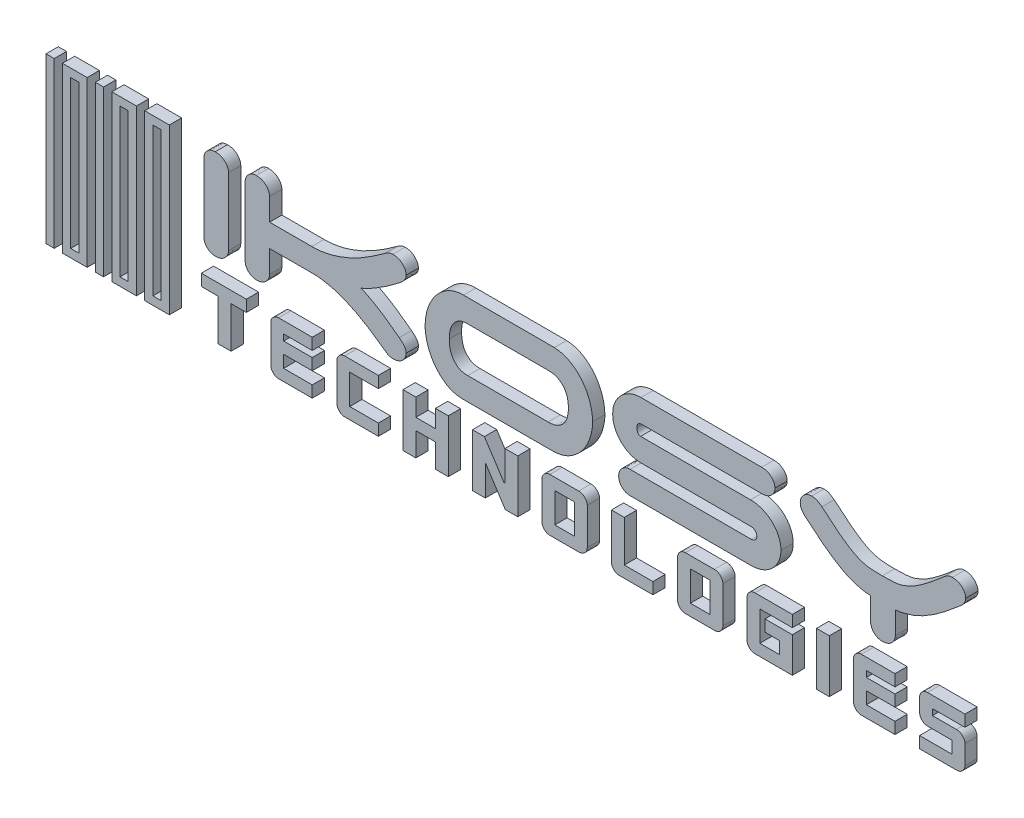
from build123d import *

# Parameters (mm, degrees)
SYMBOL_SKETCH_W        = 1.675
SYMBOL_SKETCH_H        = 33.5
SYMBOL_EXTRUDE_DEPTH   = 2.5
SYMBOL_SKETCH_W_2      = 5.025
SYMBOL_SKETCH_H_2      = 30.15
SYMBOL_EXTRUDE_2_DEPTH = 2.5
SYMBOL_EXTRUDE_3_DEPTH = 2.5
SYMBOL_EXTRUDE_4_DEPTH = 2.5
SYMBOL_EXTRUDE_5_DEPTH = 2.5
TEXT_EXTRUDE_DEPTH     = 2.5
TEXT_EXTRUDE_2_DEPTH   = 2.5
TEXT_EXTRUDE_3_DEPTH   = 2.5
TEXT_EXTRUDE_4_DEPTH   = 2.5
TEXT_EXTRUDE_5_DEPTH   = 2.5
TEXT_EXTRUDE_6_DEPTH   = 2.5
TEXT_EXTRUDE_7_DEPTH   = 2.5
TEXT_EXTRUDE_8_DEPTH   = 2.5
TEXT_EXTRUDE_9_DEPTH   = 2.5
TEXT_EXTRUDE_10_DEPTH  = 2.5
TEXT_SKETCH_W          = 3.996794872
TEXT_SKETCH_H          = 6.064102564
TEXT_EXTRUDE_11_DEPTH  = 2.5
TEXT_EXTRUDE_12_DEPTH  = 2.5
TEXT_EXTRUDE_13_DEPTH  = 2.5
TEXT_EXTRUDE_14_DEPTH  = 2.5
TEXT_SKETCH_W_2        = 2.618589744
TEXT_SKETCH_H_2        = 10.75
TEXT_EXTRUDE_15_DEPTH  = 2.5
TEXT_EXTRUDE_16_DEPTH  = 2.5
TEXT_EXTRUDE_17_DEPTH  = 2.5


with BuildPart() as part:
    # Symbol Sketch → Symbol Extrude (new body)
    with BuildSketch(Plane.XY):
        with Locations((-2.4125, 13.5)):
            Rectangle(SYMBOL_SKETCH_W, SYMBOL_SKETCH_H)
    extrude(amount=SYMBOL_EXTRUDE_DEPTH)


with BuildPart() as body_2:
    # Symbol Sketch → Symbol Extrude 2 (new body)
    with BuildSketch(Plane.XY):
        with Locations((2.6125, 13.5)):
            Rectangle(SYMBOL_SKETCH_W_2, SYMBOL_SKETCH_H)
        with Locations((2.6125, 13.5)):
            Rectangle(SYMBOL_SKETCH_W, SYMBOL_SKETCH_H_2, mode=Mode.SUBTRACT)
    extrude(amount=SYMBOL_EXTRUDE_2_DEPTH)


with BuildPart() as body_3:
    # Symbol Sketch → Symbol Extrude 3 (new body)
    with BuildSketch(Plane.XY):
        with Locations((7.6375, 13.5)):
            Rectangle(SYMBOL_SKETCH_W, SYMBOL_SKETCH_H)
    extrude(amount=SYMBOL_EXTRUDE_3_DEPTH)


with BuildPart() as body_4:
    # Symbol Sketch → Symbol Extrude 4 (new body)
    with BuildSketch(Plane.XY):
        with Locations((12.6625, 13.5)):
            Rectangle(SYMBOL_SKETCH_W_2, SYMBOL_SKETCH_H)
        with Locations((12.6625, 13.5)):
            Rectangle(SYMBOL_SKETCH_W, SYMBOL_SKETCH_H_2, mode=Mode.SUBTRACT)
    extrude(amount=SYMBOL_EXTRUDE_4_DEPTH)


with BuildPart() as body_5:
    # Symbol Sketch → Symbol Extrude 5 (new body)
    with BuildSketch(Plane.XY):
        with Locations((19.3625, 13.5)):
            Rectangle(SYMBOL_SKETCH_W_2, SYMBOL_SKETCH_H)
        with Locations((19.3625, 13.5)):
            Rectangle(SYMBOL_SKETCH_W, SYMBOL_SKETCH_H_2, mode=Mode.SUBTRACT)
    extrude(amount=SYMBOL_EXTRUDE_5_DEPTH)


with BuildPart() as body_6:
    # Text Sketch → Text Extrude (new body)
    with BuildSketch(Plane.XY):
        with BuildLine():
            add(Edge.make_bspline(
                [(33.932145172, 14.108903111), (33.922614042, 13.966464941), (33.903507078, 13.680920527), (33.756814698, 13.266172232), (33.522865011, 12.870067652), (33.203812647, 12.502559297), (32.81468528, 12.173409809), (32.340116527, 11.946153881), (31.804726107, 11.805542545), (31.425469577, 11.78902523), (31.22750324, 11.780403435)],
                knots=[0, 0, 0, 0, 0.862232898, 1.728509904, 2.637124992, 3.638458358, 4.667549052, 5.703761565, 6.801397276, 8, 8, 8, 8], degree=3))
            add(Edge.make_bspline(
                [(31.22750324, 11.780403435), (31.06944086, 11.787950422), (30.761904891, 11.802634309), (30.318705895, 11.932300503), (29.921021184, 12.154395227), (29.561828224, 12.443228094), (29.272995357, 12.802421054), (29.050900632, 13.200105765), (28.921234439, 13.643304761), (28.906550552, 13.95084073), (28.899003564, 14.108903111)],
                knots=[0, 0, 0, 0, 1.033498853, 2.010839451, 2.990522858, 4, 5.009477142, 5.989160549, 6.966501147, 8, 8, 8, 8], degree=3))
            Line((28.899003564, 14.108903111), (28.899003564, 27.876903759))
            add(Edge.make_bspline(
                [(28.899003564, 27.876903759), (28.907033893, 28.032851206), (28.922853275, 28.340060602), (29.048078277, 28.782913745), (29.274796911, 29.178618665), (29.56347736, 29.536410354), (29.919018501, 29.831830551), (30.320514074, 30.054574569), (30.764159418, 30.181885187), (31.071492837, 30.197484712), (31.22750324, 30.205403435)],
                knots=[0, 0, 0, 0, 1.021036462, 2.011395514, 2.980149812, 3.990138669, 5.008424466, 5.988604486, 6.978963538, 8, 8, 8, 8], degree=3))
            add(Edge.make_bspline(
                [(31.22750324, 30.205403435), (31.423350927, 30.196429128), (31.800366674, 30.179153176), (32.336176139, 30.041547398), (32.807589653, 29.803363866), (33.203813659, 29.479883836), (33.522620655, 29.109428844), (33.756883894, 28.713745241), (33.902788255, 28.30078682), (33.922420665, 28.017315427), (33.932145172, 27.876903759)],
                knots=[0, 0, 0, 0, 1.187948747, 2.286855633, 3.329671233, 4.369332619, 5.371825634, 6.281492993, 7.148773238, 8, 8, 8, 8], degree=3))
            Line((33.932145172, 27.876903759), (33.932145172, 14.108903111))
        make_face()
    extrude(amount=TEXT_EXTRUDE_DEPTH)


with BuildPart() as body_7:
    # Text Sketch → Text Extrude 2 (new body)
    with BuildSketch(Plane.XY):
        with BuildLine():
            Line((42.302802981, 23.321403111), (50.894369734, 23.321403111))
            add(Edge.make_bspline(
                [(50.894369734, 23.321403111), (51.236859765, 23.329352598), (51.91914667, 23.345189063), (52.937147227, 23.440022319), (53.939333875, 23.609879412), (55.264327124, 23.914788101), (56.897453942, 24.448179783), (58.821811851, 25.238227135), (60.68251169, 26.185053601), (62.461254445, 27.250703399), (64.162352307, 28.378130344), (65.259760547, 29.165193234), (65.802738172, 29.554617628)],
                knots=[0, 0, 0, 0, 0.625370962, 1.245824342, 1.864700964, 2.479950729, 3.726807079, 4.996086198, 6.27499779, 7.534434493, 8.780083059, 10, 10, 10, 10], degree=3))
            add(Edge.make_bspline(
                [(65.802738172, 29.554617628), (65.930924828, 29.655013993), (66.178529436, 29.848939036), (66.588818131, 30.051070223), (67.003097409, 30.179576829), (67.282544055, 30.196857248), (67.420746922, 30.205403435)],
                knots=[0, 0, 0, 0, 1.095900439, 2.116834999, 3.068663713, 4, 4, 4, 4], degree=3))
            add(Edge.make_bspline(
                [(67.420746922, 30.205403435), (67.616647718, 30.196658037), (67.991838803, 30.179908768), (68.525130836, 30.040324316), (68.994740749, 29.803375031), (69.391616114, 29.480176752), (69.708710831, 29.107563257), (69.951237776, 28.715573734), (70.095684871, 28.300581006), (70.115549381, 28.017247251), (70.125388853, 27.876903759)],
                knots=[0, 0, 0, 0, 1.188770155, 2.27674401, 3.320280665, 4.360660926, 5.363847116, 6.280304729, 7.148184656, 8, 8, 8, 8], degree=3))
            add(Edge.make_bspline(
                [(70.125388853, 27.876903759), (70.12089662, 27.780915742), (70.111970624, 27.590189062), (70.036709068, 27.311340692), (69.914457735, 27.043885233), (69.681849333, 26.69501161), (69.292002315, 26.271037526), (68.920230435, 25.982578593), (68.722318535, 25.829018146)],
                knots=[0, 0, 0, 0, 0.669693301, 1.330670049, 2.00266867, 2.716108566, 4.251827991, 6, 6, 6, 6], degree=3))
            add(Edge.make_bspline(
                [(68.722318535, 25.829018146), (68.384884641, 25.569126035), (67.736192283, 25.06950217), (66.771608464, 24.356770011), (65.815549149, 23.694452694), (64.836164671, 23.050465206), (63.794824961, 22.433270782), (62.909618942, 21.920630259), (62.200425207, 21.5504343), (61.713060142, 21.311872254), (61.270039702, 21.127123432), (60.985053276, 21.031281235), (60.853183733, 20.986932923)],
                knots=[0, 0, 0, 0, 1.377873125, 2.648861836, 3.879417678, 5.140173149, 6.439784966, 7.794983305, 8.44869275, 9.027502601, 9.550003875, 10, 10, 10, 10], degree=3))
            add(Edge.make_bspline(
                [(60.853183733, 20.986932923), (61.176346781, 20.865830526), (61.844021845, 20.615625402), (62.817574581, 20.10696038), (63.812537349, 19.541904628), (64.81629702, 18.938119935), (65.7989301, 18.300166516), (66.757726675, 17.622192439), (67.726462382, 16.906053887), (68.378687404, 16.408437208), (68.716348023, 16.150818211)],
                knots=[0, 0, 0, 0, 0.89323937, 1.845488394, 2.840530647, 3.858234817, 4.879263654, 5.87478663, 6.899764902, 8, 8, 8, 8], degree=3))
            add(Edge.make_bspline(
                [(68.716348023, 16.150818211), (68.916585933, 15.995454257), (69.293003808, 15.70339283), (69.682133926, 15.274661686), (69.921708237, 14.931767786), (70.036316603, 14.665397621), (70.111701204, 14.391714314), (70.120838187, 14.202927967), (70.125388853, 14.108903111)],
                knots=[0, 0, 0, 0, 1.769110466, 3.325667981, 4.028039365, 4.68216811, 5.343655115, 6, 6, 6, 6], degree=3))
            add(Edge.make_bspline(
                [(70.125388853, 14.108903111), (70.115854065, 13.966469479), (70.09673977, 13.680934162), (69.950103478, 13.266116278), (69.715922621, 12.870298508), (69.396824317, 12.500413997), (69.00242558, 12.175252855), (68.52765472, 11.945819855), (67.993861358, 11.806153822), (67.616680419, 11.789206848), (67.420746922, 11.780403435)],
                knots=[0, 0, 0, 0, 0.862519697, 1.729084847, 2.638002162, 3.639668596, 4.678472755, 5.715029937, 6.813030747, 8, 8, 8, 8], degree=3))
            add(Edge.make_bspline(
                [(67.420746922, 11.780403435), (67.282519538, 11.788899076), (67.003023319, 11.80607729), (66.591696478, 11.93458098), (66.184489931, 12.130427022), (65.940846876, 12.320711597), (65.814679196, 12.419248218)],
                knots=[0, 0, 0, 0, 0.939973017, 1.900628496, 2.912865253, 4, 4, 4, 4], degree=3))
            add(Edge.make_bspline(
                [(65.814679196, 12.419248218), (65.259996443, 12.818968023), (64.143710081, 13.623394992), (62.417835584, 14.766151854), (60.64340991, 15.841271258), (59.106363003, 16.627937945), (57.848353336, 17.177962037), (56.892058009, 17.547968314), (55.923292424, 17.87913809), (54.939140829, 18.15894719), (53.943794985, 18.389448918), (52.936095774, 18.547303185), (51.919730959, 18.65665734), (51.236969658, 18.665791087), (50.894369734, 18.670374271)],
                knots=[0, 0, 0, 0, 1.495432356, 3.00952343, 4.526603086, 6.031585771, 6.782144813, 7.529147792, 8.273927562, 9.020803678, 9.766397276, 10.507145663, 11.250906896, 12, 12, 12, 12], degree=3))
            Line((50.894369734, 18.670374271), (42.302802981, 18.670374271))
            Line((42.302802981, 18.670374271), (42.302802981, 14.108903111))
            add(Edge.make_bspline(
                [(42.302802981, 14.108903111), (42.293271477, 13.966465609), (42.274163762, 13.680922534), (42.127477128, 13.266163996), (41.893503758, 12.87010163), (41.574550559, 12.502416518), (41.186407817, 12.175116475), (40.718809015, 11.947115476), (40.195443175, 11.805875135), (39.825994082, 11.789114346), (39.633984122, 11.780403435)],
                knots=[0, 0, 0, 0, 0.869868558, 1.743817038, 2.660478533, 3.670679389, 4.708883383, 5.743368767, 6.827184362, 8, 8, 8, 8], degree=3))
            add(Edge.make_bspline(
                [(39.633984122, 11.780403435), (39.475921741, 11.787950422), (39.168385772, 11.802634309), (38.725186776, 11.932300503), (38.327502065, 12.154395227), (37.968309105, 12.443228094), (37.679476238, 12.802421054), (37.457381514, 13.200105765), (37.32771532, 13.643304761), (37.313031433, 13.95084073), (37.305484446, 14.108903111)],
                knots=[0, 0, 0, 0, 1.033498853, 2.010839451, 2.990522858, 4, 5.009477142, 5.989160549, 6.966501147, 8, 8, 8, 8], degree=3))
            Line((37.305484446, 14.108903111), (37.305484446, 27.876903759))
            add(Edge.make_bspline(
                [(37.305484446, 27.876903759), (37.313515377, 28.032850394), (37.329335946, 28.34005819), (37.454552313, 28.782922971), (37.681303311, 29.17858427), (37.969858014, 29.536545445), (38.324518307, 29.830210928), (38.717503069, 30.051946414), (39.146284047, 30.182256679), (39.442064386, 30.197610471), (39.592190538, 30.205403435)],
                knots=[0, 0, 0, 0, 1.03238026, 2.033742283, 3.013259521, 4.034469437, 5.064068473, 6.043585711, 7.007003139, 8, 8, 8, 8], degree=3))
            add(Edge.make_bspline(
                [(39.592190538, 30.205403435), (39.788034287, 30.196426788), (40.165042456, 30.179146333), (40.700904615, 30.041571865), (41.172131128, 29.803277221), (41.569036365, 29.480201967), (41.886123497, 29.107557234), (42.128652257, 28.715575188), (42.273098915, 28.300580659), (42.292963481, 28.017247136), (42.302802981, 27.876903759)],
                knots=[0, 0, 0, 0, 1.187035174, 2.285096964, 3.327110603, 4.365972454, 5.367694518, 6.282814583, 7.14942786, 8, 8, 8, 8], degree=3))
            Line((42.302802981, 27.876903759), (42.302802981, 23.321403111))
        make_face()
    extrude(amount=TEXT_EXTRUDE_2_DEPTH)


with BuildPart() as body_8:
    # Text Sketch → Text Extrude 3 (new body)
    with BuildSketch(Plane.XY):
        with BuildLine():
            add(Edge.make_bspline(
                [(108.103815619, 20.992903435), (108.098994555, 20.739778597), (108.08923799, 20.227520473), (107.978605779, 19.455852479), (107.819846709, 18.670927302), (107.592341935, 17.883126299), (107.30966344, 17.10213342), (106.957211048, 16.348063398), (106.533786331, 15.627342161), (106.054542305, 14.937440879), (105.510051664, 14.288777697), (104.897582965, 13.695018374), (104.218407849, 13.157346485), (103.48395845, 12.670657099), (102.678457415, 12.271781024), (101.805362662, 11.982853389), (100.865937433, 11.815943879), (100.219420637, 11.792438605), (99.888391121, 11.780403435)],
                knots=[0, 0, 0, 0, 0.887562666, 1.79619349, 2.730230654, 3.696171481, 4.670456872, 5.642035631, 6.612182846, 7.600186341, 8.58641134, 9.579043665, 10.587854658, 11.622157229, 12.665262734, 13.731876165, 14.838675282, 16, 16, 16, 16], degree=3))
            Line((99.888391121, 11.780403435), (81.409656513, 11.780403435))
            add(Edge.make_bspline(
                [(81.409656513, 11.780403435), (81.120080298, 11.805027634), (80.553167744, 11.85323521), (79.733046752, 12.04698083), (78.967087831, 12.342736658), (78.255416533, 12.732920524), (77.60142467, 13.204360111), (76.986876696, 13.722404366), (76.433625026, 14.304728526), (75.929101432, 14.933241115), (75.483864736, 15.609069759), (75.088187379, 16.318602332), (74.75500702, 17.063106591), (74.472482484, 17.82984952), (74.260066763, 18.618017553), (74.106108133, 19.410147191), (74.004026262, 20.202144023), (73.993537332, 20.729895365), (73.98831011, 20.992903435)],
                knots=[0, 0, 0, 0, 1.071895832, 2.098484516, 3.098701618, 4.095024705, 5.085859565, 6.070929021, 7.058325083, 8.046349754, 9.042889575, 10.042755757, 11.042486936, 12.051303591, 13.056635549, 14.052389487, 15.029396535, 16, 16, 16, 16], degree=3))
            add(Edge.make_bspline(
                [(73.98831011, 20.992903435), (73.996453928, 21.259799624), (74.01285149, 21.797194639), (74.107152996, 22.603067742), (74.280494058, 23.407524075), (74.504264709, 24.211021805), (74.791391065, 25.000776499), (75.156734369, 25.754886724), (75.565846808, 26.482279712), (76.044021656, 27.167508049), (76.579761356, 27.806781891), (77.173896669, 28.388337532), (77.820278769, 28.910544264), (78.520884139, 29.365050122), (79.269626885, 29.749506534), (80.080933658, 30.007743163), (80.934941379, 30.176835259), (81.522259541, 30.195758207), (81.821621841, 30.205403435)],
                knots=[0, 0, 0, 0, 0.957572403, 1.928070379, 2.905345163, 3.906550234, 4.91841359, 5.914694441, 6.909080783, 7.909165367, 8.907311603, 9.896765544, 10.886811641, 11.882811104, 12.888485635, 13.895350359, 14.927237742, 16, 16, 16, 16], degree=3))
            Line((81.821621841, 30.205403435), (100.312297472, 30.199432923))
            add(Edge.make_bspline(
                [(100.312297472, 30.199432923), (100.631834833, 30.173539771), (101.254881866, 30.123052242), (102.154007255, 29.91528616), (102.991004153, 29.608985534), (103.749552828, 29.180566938), (104.445481955, 28.69159588), (105.084492434, 28.151229995), (105.658739995, 27.557898158), (106.171435647, 26.918222415), (106.625003555, 26.242207648), (107.022685041, 25.537236437), (107.34793102, 24.798696915), (107.623728828, 24.043325569), (107.836156998, 23.276113324), (107.994136509, 22.51066809), (108.085848702, 21.749435914), (108.097854751, 21.243897545), (108.103815619, 20.992903435)],
                knots=[0, 0, 0, 0, 1.15756904, 2.257075526, 3.324770562, 4.368045022, 5.395925654, 6.396323121, 7.388434129, 8.376048353, 9.355769955, 10.328466472, 11.297804901, 12.26956978, 13.233097401, 14.172774794, 15.092803254, 16, 16, 16, 16], degree=3))
        make_face()
        with BuildLine():
            add(Edge.make_bspline(
                [(99.040578419, 16.431432275), (99.243897065, 16.437081139), (99.632489858, 16.447877533), (100.18802075, 16.531466029), (100.686814716, 16.669738736), (101.123442017, 16.878626023), (101.502358622, 17.127693027), (101.849516883, 17.387082516), (102.1426992, 17.683937178), (102.479176496, 18.107821947), (102.808926063, 18.705236526), (103.029282317, 19.485352924), (103.162093607, 20.251905951), (103.181120372, 20.755602281), (103.190084251, 20.992903435)],
                knots=[0, 0, 0, 0, 1.046644794, 2.000400019, 2.885908836, 3.701969816, 4.480954947, 5.218948154, 5.92916188, 6.622234248, 8.002950174, 9.406752558, 10.778270606, 12, 12, 12, 12], degree=3))
            add(Edge.make_bspline(
                [(103.190084251, 20.992903435), (103.181274628, 21.230249801), (103.162648178, 21.732078326), (103.027885498, 22.495942577), (102.811647688, 23.274420867), (102.473946787, 23.866050185), (102.145204484, 24.298008061), (101.84133427, 24.590086005), (101.498840838, 24.859046486), (101.115885942, 25.108473533), (100.677889717, 25.313462087), (100.180461639, 25.455602039), (99.628403665, 25.537344971), (99.241871168, 25.548543032), (99.040578419, 25.554374595)],
                knots=[0, 0, 0, 0, 1.222567146, 2.584910299, 3.989675285, 5.362363695, 6.06397828, 6.781967681, 7.526778103, 8.306297391, 9.132203488, 10.00847181, 10.962881034, 12, 12, 12, 12], degree=3))
            Line((99.040578419, 25.554374595), (82.675405055, 25.554374595))
            add(Edge.make_bspline(
                [(82.675405055, 25.554374595), (82.497937462, 25.550752617), (82.157052429, 25.543795413), (81.674107929, 25.465025615), (81.240000806, 25.342278181), (80.744603668, 25.102511717), (80.206936937, 24.7019452), (79.681172218, 24.100128412), (79.297137346, 23.381220865), (79.05673027, 22.592580808), (78.928941369, 21.787289462), (78.910815651, 21.252015283), (78.902041478, 20.992903435)],
                knots=[0, 0, 0, 0, 0.794200639, 1.525524215, 2.185566194, 2.807611374, 3.980821995, 5.16243582, 6.359119684, 7.602475229, 8.839422673, 10, 10, 10, 10], degree=3))
            add(Edge.make_bspline(
                [(78.902041478, 20.992903435), (78.910672361, 20.731755998), (78.928497016, 20.192429643), (79.058136414, 19.38447879), (79.288564784, 18.590088861), (79.680517926, 17.875383855), (80.208600434, 17.280468803), (80.736550278, 16.875748608), (81.232707834, 16.6424747), (81.666311803, 16.521535944), (82.153033754, 16.441567634), (82.495934168, 16.434914476), (82.675405055, 16.431432275)],
                knots=[0, 0, 0, 0, 1.168189698, 2.412566253, 3.651898492, 4.851533932, 6.025141351, 7.189898139, 7.799403787, 8.467261891, 9.19777913, 10, 10, 10, 10], degree=3))
            Line((82.675405055, 16.431432275), (99.040578419, 16.431432275))
        make_face(mode=Mode.SUBTRACT)
    extrude(amount=TEXT_EXTRUDE_3_DEPTH)


with BuildPart() as body_9:
    # Text Sketch → Text Extrude 4 (new body)
    with BuildSketch(Plane.XY):
        with BuildLine():
            add(Edge.make_bspline(
                [(117.967101426, 18.670374271), (117.767826032, 18.676573655), (117.373494254, 18.68884117), (116.792509249, 18.772488617), (116.235047021, 18.91752527), (115.700181195, 19.114296202), (115.197637637, 19.36658068), (114.720921592, 19.651670476), (114.285465013, 19.985000758), (113.874989484, 20.345776911), (113.514213331, 20.75625244), (113.180883049, 21.191709019), (112.895793252, 21.668425065), (112.643508775, 22.170968622), (112.446737843, 22.705834449), (112.30170119, 23.263296677), (112.218053743, 23.844281681), (112.205786228, 24.238613459), (112.199586844, 24.437888853)],
                knots=[0, 0, 0, 0, 1.055198062, 2.088055732, 3.10027589, 4.100630988, 5.099819621, 6.074018954, 7.037268981, 8, 8.962731019, 9.925981046, 10.900180379, 11.899369012, 12.89972411, 13.911944268, 14.944801938, 16, 16, 16, 16], degree=3))
            add(Edge.make_bspline(
                [(112.199586844, 24.437888853), (112.205793792, 24.637167824), (112.218076278, 25.031506681), (112.301339136, 25.610528318), (112.446155917, 26.167058901), (112.650978508, 26.697506801), (112.901267048, 27.201594027), (113.187073415, 27.677939183), (113.519793903, 28.113978979), (113.883188602, 28.523490725), (114.289668408, 28.893366911), (114.732857304, 29.221330903), (115.207558828, 29.511175179), (115.716635677, 29.753921897), (116.248103026, 29.958143698), (116.804512167, 30.10300862), (117.379405186, 30.187012652), (117.769802299, 30.199229352), (117.967101426, 30.205403435)],
                knots=[0, 0, 0, 0, 1.056069126, 2.089779418, 3.092625705, 4.097522181, 5.097535642, 6.072539174, 7.036584362, 8.000110114, 8.970710769, 9.943200813, 10.918204345, 11.913590283, 12.928346752, 13.931193039, 14.954465097, 16, 16, 16, 16], degree=3))
            Line((117.967101426, 30.205403435), (142.553669799, 30.205403435))
            add(Edge.make_bspline(
                [(142.553669799, 30.205403435), (142.749513548, 30.196426788), (143.126521717, 30.179146333), (143.662383876, 30.041571865), (144.133610389, 29.803277221), (144.530515626, 29.480201967), (144.847602758, 29.107557234), (145.090131519, 28.715575188), (145.234578177, 28.300580659), (145.254442742, 28.017247136), (145.264282242, 27.876903759)],
                knots=[0, 0, 0, 0, 1.187035174, 2.285096964, 3.327110603, 4.365972454, 5.367694518, 6.282814583, 7.14942786, 8, 8, 8, 8], degree=3))
            add(Edge.make_bspline(
                [(145.264282242, 27.876903759), (145.254558795, 27.736489983), (145.234928523, 27.453014335), (145.089007628, 27.040088822), (144.854812725, 26.644269206), (144.53571872, 26.274385466), (144.141318469, 25.949223258), (143.666549111, 25.719793784), (143.130817234, 25.579607633), (142.751610265, 25.563028604), (142.553669799, 25.554374595)],
                knots=[0, 0, 0, 0, 0.850520932, 1.717082035, 2.625995105, 3.627656861, 4.666456168, 5.70300851, 6.801004192, 8, 8, 8, 8], degree=3))
            Line((142.553669799, 25.554374595), (117.88948477, 25.554374595))
            add(Edge.make_bspline(
                [(117.88948477, 25.554374595), (117.813693239, 25.537232398), (117.62716047, 25.495043232), (117.429143648, 25.322383553), (117.262655636, 25.138264225), (117.175018573, 24.938359985), (117.121513826, 24.701504313), (117.116175554, 24.529796523), (117.113318211, 24.437888853)],
                knots=[0, 0, 0, 0, 0.929705688, 2.288126067, 3.074503345, 3.925707183, 4.889721779, 6, 6, 6, 6], degree=3))
            add(Edge.make_bspline(
                [(117.113318211, 24.437888853), (117.116153737, 24.349925916), (117.121500042, 24.184074209), (117.177186883, 23.951978296), (117.262629401, 23.750174212), (117.426348787, 23.558642274), (117.628647155, 23.388903106), (117.813879252, 23.340968434), (117.88948477, 23.321403111)],
                knots=[0, 0, 0, 0, 1.066464062, 2.010788751, 2.887353709, 3.695542847, 5.059398025, 6, 6, 6, 6], degree=3))
            Line((117.88948477, 23.321403111), (140.284875243, 23.321403111))
            add(Edge.make_bspline(
                [(140.284875243, 23.321403111), (140.506126286, 23.316172652), (140.94477772, 23.305802766), (141.591380853, 23.207561896), (142.215157032, 23.045924503), (142.811017763, 22.823018293), (143.37304302, 22.558547849), (143.89309044, 22.25100522), (144.365254622, 21.905130974), (144.789814034, 21.521663946), (145.170686172, 21.106374178), (145.501954281, 20.657479368), (145.800968925, 20.183915297), (146.0407417, 19.676914162), (146.24054355, 19.155214304), (146.37771894, 18.616203761), (146.46373728, 18.068134257), (146.476088556, 17.697491275), (146.482266688, 17.512094945)],
                knots=[0, 0, 0, 0, 1.125524374, 2.23146012, 3.319860629, 4.399933111, 5.464745038, 6.47755185, 7.470303123, 8.438566666, 9.385019312, 10.333150884, 11.274821239, 12.230766696, 13.182786281, 14.113937299, 15.056587825, 16, 16, 16, 16], degree=3))
            add(Edge.make_bspline(
                [(146.482266688, 17.512094945), (146.475923937, 17.326742819), (146.463243556, 16.956188208), (146.379605245, 16.406955325), (146.233407915, 15.871767761), (146.037020814, 15.354077115), (145.791235887, 14.856108959), (145.498297006, 14.385006737), (145.160952166, 13.93891237), (144.779724109, 13.522795673), (144.357654595, 13.137604283), (143.882159818, 12.803375097), (143.371510524, 12.494487552), (142.810088344, 12.244245829), (142.219996632, 12.028470321), (141.595188683, 11.89167754), (140.948543357, 11.796281326), (140.508139085, 11.785744898), (140.284875243, 11.780403435)],
                knots=[0, 0, 0, 0, 0.947658347, 1.894551617, 2.832491261, 3.779275183, 4.721235255, 5.667143943, 6.611409382, 7.57649714, 8.549118708, 9.52614791, 10.54351323, 11.595303979, 12.663746289, 13.749776913, 14.859244828, 16, 16, 16, 16], degree=3))
            Line((140.284875243, 11.780403435), (115.740100454, 11.780403435))
            add(Edge.make_bspline(
                [(115.740100454, 11.780403435), (115.58404776, 11.788114315), (115.278545022, 11.803209824), (114.83727467, 11.932297149), (114.439588618, 12.154396157), (114.080396028, 12.443227841), (113.791563061, 12.80242112), (113.569468363, 13.200105748), (113.439802162, 13.643304766), (113.425118277, 13.950840732), (113.41757129, 14.108903111)],
                knots=[0, 0, 0, 0, 1.022177595, 2.001106468, 2.982381959, 3.993499602, 5.004617245, 5.985892735, 6.964821609, 8, 8, 8, 8], degree=3))
            add(Edge.make_bspline(
                [(113.41757129, 14.108903111), (113.425608371, 14.264842559), (113.441441055, 14.572036197), (113.566569286, 15.015003974), (113.79365064, 15.410279222), (114.080126494, 15.768745232), (114.439658444, 16.057403967), (114.837256362, 16.279547891), (115.278549831, 16.408623434), (115.584049386, 16.423720566), (115.740100454, 16.431432275)],
                knots=[0, 0, 0, 0, 1.023700639, 2.016643822, 2.987925878, 4.000550086, 5.013174293, 5.995911884, 6.976299361, 8, 8, 8, 8], degree=3))
            Line((115.740100454, 16.431432275), (140.452049579, 16.431432275))
            add(Edge.make_bspline(
                [(140.452049579, 16.431432275), (140.595308378, 16.445480381), (140.885343765, 16.47392155), (141.189737596, 16.693027008), (141.389034421, 16.905666708), (141.488466705, 17.09718427), (141.562474746, 17.297704917), (141.566489843, 17.439737111), (141.568535321, 17.512094945)],
                knots=[0, 0, 0, 0, 1.483557837, 3.00354516, 3.785710979, 4.522423995, 5.247253764, 6, 6, 6, 6], degree=3))
            add(Edge.make_bspline(
                [(141.568535321, 17.512094945), (141.563347173, 17.590084756), (141.553341951, 17.74048629), (141.492049242, 17.959432237), (141.381949002, 18.157762196), (141.233271931, 18.332857523), (141.062190937, 18.483687581), (140.871302125, 18.59234404), (140.664763601, 18.654847666), (140.524107867, 18.66511453), (140.452049579, 18.670374271)],
                knots=[0, 0, 0, 0, 1.052637569, 2.029987015, 3.039270143, 4.08779047, 5.115827877, 6.101623483, 7.027456916, 8, 8, 8, 8], degree=3))
            Line((140.452049579, 18.670374271), (117.967101426, 18.670374271))
        make_face()
    extrude(amount=TEXT_EXTRUDE_4_DEPTH)


with BuildPart() as body_10:
    # Text Sketch → Text Extrude 5 (new body)
    with BuildSketch(Plane.XY):
        with BuildLine():
            add(Edge.make_bspline(
                [(169.785174984, 14.108903111), (169.775640196, 13.966469478), (169.7565259, 13.680934159), (169.609889613, 13.266116288), (169.375708737, 12.870298463), (169.056610511, 12.500414184), (168.662211468, 12.175252131), (168.187441779, 11.945822615), (167.651709996, 11.805636476), (167.272503014, 11.789057445), (167.074562541, 11.780403435)],
                knots=[0, 0, 0, 0, 0.861224399, 1.726488175, 2.634040514, 3.634202684, 4.671446808, 5.70644733, 6.802799205, 8, 8, 8, 8], degree=3))
            add(Edge.make_bspline(
                [(167.074562541, 11.780403435), (166.918509847, 11.788114315), (166.613007109, 11.803209824), (166.171736757, 11.932297149), (165.774050705, 12.154396157), (165.414858115, 12.443227841), (165.126025148, 12.80242112), (164.90393045, 13.200105748), (164.774264249, 13.643304766), (164.759580363, 13.950840732), (164.752033377, 14.108903111)],
                knots=[0, 0, 0, 0, 1.022177595, 2.001106468, 2.982381959, 3.993499602, 5.004617245, 5.985892735, 6.964821609, 8, 8, 8, 8], degree=3))
            Line((164.752033377, 14.108903111), (164.752033377, 18.670374271))
            add(Edge.make_bspline(
                [(164.752033377, 18.670374271), (164.542760822, 18.674234631), (164.108690089, 18.682241745), (163.443951576, 18.776401774), (162.73853887, 18.897315269), (162.005219937, 19.084183228), (161.246085879, 19.324044372), (160.469376603, 19.615858209), (159.680287482, 19.969665537), (158.877625079, 20.386557884), (158.048511011, 20.858728965), (157.201357226, 21.404830958), (156.316106751, 22.003466698), (155.40517876, 22.674684194), (154.450120482, 23.413847072), (153.449447625, 24.227156146), (152.392084547, 25.110337465), (151.675658489, 25.730380854), (151.306440376, 26.04992709)],
                knots=[0, 0, 0, 0, 0.641398825, 1.330382084, 2.055978345, 2.836185825, 3.648952849, 4.496988013, 5.379557769, 6.299582378, 7.270216231, 8.304862195, 9.390111043, 10.547532482, 11.774599775, 13.093996411, 14.502358824, 16, 16, 16, 16], degree=3))
            add(Edge.make_bspline(
                [(151.306440376, 26.04992709), (151.189006949, 26.167957817), (150.947903315, 26.410287775), (150.657981861, 26.843712509), (150.447031447, 27.339995479), (150.422935578, 27.697696162), (150.410863577, 27.876903759)],
                knots=[0, 0, 0, 0, 0.953032214, 1.956679093, 2.976298768, 4, 4, 4, 4], degree=3))
            add(Edge.make_bspline(
                [(150.410863577, 27.876903759), (150.418893906, 28.032851206), (150.434713288, 28.340060602), (150.55993829, 28.782913745), (150.786656924, 29.178618665), (151.075337373, 29.536410354), (151.430878514, 29.831830551), (151.832374087, 30.054574569), (152.276019431, 30.181885187), (152.58335285, 30.197484712), (152.739363253, 30.205403435)],
                knots=[0, 0, 0, 0, 1.021036462, 2.011395514, 2.980149812, 3.990138669, 5.008424466, 5.988604486, 6.978963538, 8, 8, 8, 8], degree=3))
            add(Edge.make_bspline(
                [(152.739363253, 30.205403435), (152.937832621, 30.199933525), (153.298072053, 30.190005156), (153.722175862, 30.05121232), (154.01629083, 29.890651276), (154.258928188, 29.744562647), (154.530836701, 29.565999418), (154.721877452, 29.433661028), (154.823071938, 29.363561244)],
                knots=[0, 0, 0, 0, 1.550277569, 2.813890719, 3.449254088, 4.17735297, 5.034541965, 6, 6, 6, 6], degree=3))
            add(Edge.make_bspline(
                [(154.823071938, 29.363561244), (155.232045349, 29.010128564), (156.007722684, 28.339792275), (157.122311852, 27.407741649), (158.124057841, 26.605368451), (159.025918389, 25.926315012), (159.846766108, 25.347090968), (160.61431779, 24.866740563), (161.32927606, 24.459748785), (162.000940376, 24.132935749), (162.645843149, 23.880474893), (163.262143554, 23.674442588), (163.863612145, 23.529853955), (164.457209892, 23.439128272), (165.064063058, 23.391058114), (165.706736442, 23.346293988), (166.395749284, 23.323551995), (166.871553079, 23.322133125), (167.116356124, 23.321403111)],
                knots=[0, 0, 0, 0, 1.836146017, 3.482516976, 4.935327597, 6.195494878, 7.317033276, 8.346813987, 9.270068544, 10.110663513, 10.881484832, 11.621201485, 12.31645431, 12.980022201, 13.658809721, 14.383734916, 15.168424845, 16, 16, 16, 16], degree=3))
            add(Edge.make_bspline(
                [(167.116356124, 23.321403111), (167.373108675, 23.321924823), (167.868826281, 23.322932104), (168.58545423, 23.348139987), (169.24617539, 23.384705581), (169.86730106, 23.426016131), (170.470371073, 23.518587398), (171.084951806, 23.660989979), (171.716466722, 23.876208002), (172.381025619, 24.139019775), (173.079060199, 24.478678289), (173.817012835, 24.898140943), (174.599359752, 25.398072664), (175.282906471, 25.866472519), (175.856577477, 26.296873411), (176.330123331, 26.654684064), (176.833856503, 27.050632133), (177.364126392, 27.484362083), (177.93196383, 27.944540784), (178.520645886, 28.449369852), (179.145683531, 28.982269952), (179.569273708, 29.353123116), (179.785782566, 29.542676604)],
                knots=[0, 0, 0, 0, 1.057356201, 2.041460081, 2.952579034, 3.782999482, 4.603695654, 5.462550415, 6.377495452, 7.348542422, 8.404309042, 9.571413422, 10.842502825, 12.227097685, 12.982804895, 13.795894059, 14.67148133, 15.621299327, 16.617244161, 17.6814085, 18.81490264, 20, 20, 20, 20], degree=3))
            add(Edge.make_bspline(
                [(179.785782566, 29.542676604), (179.917881956, 29.645299245), (180.169804726, 29.841007794), (180.584862955, 30.043366879), (180.996999843, 30.181259762), (181.277361662, 30.197425128), (181.41573234, 30.205403435)],
                knots=[0, 0, 0, 0, 1.116180587, 2.128634399, 3.076400182, 4, 4, 4, 4], degree=3))
            add(Edge.make_bspline(
                [(181.41573234, 30.205403435), (181.611576089, 30.196426788), (181.988584257, 30.179146333), (182.524446416, 30.041571865), (182.99567293, 29.803277221), (183.392578166, 29.480201967), (183.709665298, 29.107557234), (183.952194059, 28.715575188), (184.096640717, 28.300580659), (184.116505283, 28.017247136), (184.126344783, 27.876903759)],
                knots=[0, 0, 0, 0, 1.187035174, 2.285096964, 3.327110603, 4.365972454, 5.367694518, 6.282814583, 7.14942786, 8, 8, 8, 8], degree=3))
            add(Edge.make_bspline(
                [(184.126344783, 27.876903759), (184.114715549, 27.723810257), (184.090436146, 27.404183114), (183.880819259, 26.93644629), (183.547446326, 26.472883595), (183.252401018, 26.19801289), (183.093446209, 26.04992709)],
                knots=[0, 0, 0, 0, 0.846631323, 1.767588747, 2.797294875, 4, 4, 4, 4], degree=3))
            add(Edge.make_bspline(
                [(183.093446209, 26.04992709), (182.749699879, 25.754744277), (182.073641622, 25.174197633), (181.067906281, 24.3295757), (180.074588339, 23.544338226), (179.111930297, 22.80141617), (178.168075082, 22.123551802), (177.258072074, 21.497142594), (176.363987456, 20.94941229), (175.499203755, 20.454631135), (174.648710578, 20.031332823), (173.815617155, 19.661935639), (172.990776845, 19.358950689), (172.193027531, 19.111815765), (171.452105733, 18.925164371), (170.803150446, 18.786867305), (170.259367899, 18.694649463), (169.930709121, 18.677824549), (169.785174984, 18.670374271)],
                knots=[0, 0, 0, 0, 1.405337354, 2.763927467, 4.073070632, 5.332368463, 6.535021961, 7.676977369, 8.757910683, 9.786166288, 10.766154311, 11.703149807, 12.611296932, 13.489908946, 14.292364098, 14.980007543, 15.548334831, 16, 16, 16, 16], degree=3))
            Line((169.785174984, 18.670374271), (169.785174984, 14.108903111))
        make_face()
    extrude(amount=TEXT_EXTRUDE_5_DEPTH)


with BuildPart() as body_11:
    # Text Sketch → Text Extrude 6 (new body)
    with BuildSketch(Plane.XY):
        Polygon((37.566446314, 5.019230769), (34.452564103, 5.019230769), (34.452564103, -3.387820513), (31.833974359, -3.387820513), (31.833974359, 5.019230769), (28.388461538, 5.019230769), (28.388461538, 7.362179487), (37.566446314, 7.362179487), align=None)
    extrude(amount=TEXT_EXTRUDE_6_DEPTH)


with BuildPart() as body_12:
    # Text Sketch → Text Extrude 7 (new body)
    with BuildSketch(Plane.XY):
        with BuildLine():
            Line((50.991973157, -3.387820513), (44.141862981, -3.387820513))
            add(Edge.make_bspline(
                [(44.141862981, -3.387820513), (44.087903849, -3.38706862), (43.981584766, -3.385587118), (43.825611592, -3.359109363), (43.674364237, -3.325283537), (43.530919239, -3.268046303), (43.391010057, -3.203473258), (43.257736019, -3.119673336), (43.13174288, -3.020486706), (43.011757549, -2.909281054), (42.901509135, -2.787661866), (42.80898053, -2.655633375), (42.72344583, -2.522086803), (42.661131143, -2.378654347), (42.607029782, -2.231116722), (42.572809295, -2.076766955), (42.546135829, -1.917210814), (42.544726288, -1.808748844), (42.54400641, -1.753355369)],
                knots=[0, 0, 0, 0, 1.018185487, 2.006195112, 2.983343043, 3.940706292, 4.917571715, 5.89245729, 6.90729392, 7.943926622, 8.981446471, 10.00170814, 10.988133445, 11.971569574, 12.949752669, 13.953284623, 14.95470571, 16, 16, 16, 16], degree=3))
            Line((42.54400641, -1.753355369), (42.54400641, 5.727714343))
            add(Edge.make_bspline(
                [(42.54400641, 5.727714343), (42.544829941, 5.782373888), (42.546463511, 5.890797484), (42.572182671, 6.049837501), (42.607697224, 6.203810616), (42.660247875, 6.351636601), (42.727364144, 6.493237432), (42.806792807, 6.630910703), (42.90484425, 6.759293568), (43.014446342, 6.881473283), (43.132404851, 6.99524272), (43.261324769, 7.09130665), (43.391978472, 7.177641024), (43.531998882, 7.24334942), (43.675362087, 7.298760441), (43.826220038, 7.333874075), (43.981605807, 7.359870553), (44.087910932, 7.361402163), (44.141862981, 7.362179487)],
                knots=[0, 0, 0, 0, 1.032407883, 2.047901701, 3.038877924, 4.01769447, 5.007461449, 5.999181091, 7.017211835, 8.055403561, 9.1019911, 10.109195778, 11.091957287, 12.057221282, 13.027910023, 13.992505718, 14.981155157, 16, 16, 16, 16], degree=3))
            Line((44.141862981, 7.362179487), (50.991973157, 7.362179487))
            Line((50.991973157, 7.362179487), (50.991973157, 5.019230769))
            Line((50.991973157, 5.019230769), (45.162596154, 5.019230769))
            Line((45.162596154, 5.019230769), (45.162596154, 3.778846154))
            Line((45.162596154, 3.778846154), (50.991973157, 3.778846154))
            Line((50.991973157, 3.778846154), (50.991973157, 1.435897436))
            Line((50.991973157, 1.435897436), (45.162596154, 1.435897436))
            Line((45.162596154, 1.435897436), (45.162596154, -1.044871795))
            Line((45.162596154, -1.044871795), (50.991973157, -1.044871795))
            Line((50.991973157, -1.044871795), (50.991973157, -3.387820513))
        make_face()
    extrude(amount=TEXT_EXTRUDE_7_DEPTH)


with BuildPart() as body_13:
    # Text Sketch → Text Extrude 8 (new body)
    with BuildSketch(Plane.XY):
        with BuildLine():
            Line((64.458415465, -3.387820513), (57.608305288, -3.387820513))
            add(Edge.make_bspline(
                [(57.608305288, -3.387820513), (57.554346156, -3.38706862), (57.448027074, -3.385587118), (57.2920539, -3.359109363), (57.140806545, -3.325283537), (56.997361546, -3.268046303), (56.857452364, -3.203473258), (56.724178326, -3.119673336), (56.598185188, -3.020486706), (56.478199857, -2.909281054), (56.367951442, -2.787661866), (56.275422837, -2.655633375), (56.189888138, -2.522086803), (56.12757345, -2.378654347), (56.07347209, -2.231116722), (56.039251602, -2.076766955), (56.012578137, -1.917210814), (56.011168596, -1.808748844), (56.010448718, -1.753355369)],
                knots=[0, 0, 0, 0, 1.018185487, 2.006195112, 2.983343043, 3.940706292, 4.917571715, 5.89245729, 6.90729392, 7.943926622, 8.981446471, 10.00170814, 10.988133445, 11.971569574, 12.949752669, 13.953284623, 14.95470571, 16, 16, 16, 16], degree=3))
            Line((56.010448718, -1.753355369), (56.010448718, 5.727714343))
            add(Edge.make_bspline(
                [(56.010448718, 5.727714343), (56.011272249, 5.782373888), (56.012905819, 5.890797484), (56.038624978, 6.049837501), (56.074139532, 6.203810616), (56.126690183, 6.351636601), (56.193806452, 6.493237432), (56.273235114, 6.630910703), (56.371286557, 6.759293568), (56.48088865, 6.881473283), (56.598847159, 6.99524272), (56.727767077, 7.09130665), (56.858420779, 7.177641024), (56.99844119, 7.24334942), (57.141804395, 7.298760441), (57.292662346, 7.333874075), (57.448048114, 7.359870553), (57.55435324, 7.361402163), (57.608305288, 7.362179487)],
                knots=[0, 0, 0, 0, 1.032407883, 2.047901701, 3.038877924, 4.01769447, 5.007461449, 5.999181091, 7.017211835, 8.055403561, 9.1019911, 10.109195778, 11.091957287, 12.057221282, 13.027910023, 13.992505718, 14.981155157, 16, 16, 16, 16], degree=3))
            Line((57.608305288, 7.362179487), (64.458415465, 7.362179487))
            Line((64.458415465, 7.362179487), (64.458415465, 5.019230769))
            Line((64.458415465, 5.019230769), (58.629038462, 5.019230769))
            Line((58.629038462, 5.019230769), (58.629038462, -1.044871795))
            Line((58.629038462, -1.044871795), (64.458415465, -1.044871795))
            Line((64.458415465, -1.044871795), (64.458415465, -3.387820513))
        make_face()
    extrude(amount=TEXT_EXTRUDE_8_DEPTH)


with BuildPart() as body_14:
    # Text Sketch → Text Extrude 9 (new body)
    with BuildSketch(Plane.XY):
        Polygon((78.710865385, -3.387820513), (76.092275641, -3.387820513), (76.092275641, 1.435897436), (72.095480769, 1.435897436), (72.095480769, -3.387820513), (69.476891026, -3.387820513), (69.476891026, 7.362179487), (72.095480769, 7.362179487), (72.095480769, 3.778846154), (76.092275641, 3.778846154), (76.092275641, 7.362179487), (78.710865385, 7.362179487), align=None)
    extrude(amount=TEXT_EXTRUDE_9_DEPTH)


with BuildPart() as body_15:
    # Text Sketch → Text Extrude 10 (new body)
    with BuildSketch(Plane.XY):
        Polygon((92.866410256, -3.387820513), (90.312423878, -3.387820513), (86.251025641, 2.885166266), (86.251025641, -3.387820513), (83.632435897, -3.387820513), (83.632435897, 7.362179487), (86.065829327, 7.362179487), (90.209058494, 1.020282452), (90.247820513, 7.362179487), (92.866410256, 7.362179487), align=None)
    extrude(amount=TEXT_EXTRUDE_10_DEPTH)


with BuildPart() as body_16:
    # Text Sketch → Text Extrude 11 (new body)
    with BuildSketch(Plane.XY):
        with BuildLine():
            add(Edge.make_bspline(
                [(107.021955128, -1.753355369), (107.01992512, -1.805088771), (107.015904526, -1.907550949), (106.995127892, -2.05958674), (106.954710471, -2.206967586), (106.902470243, -2.351707677), (106.828657, -2.489746871), (106.745013168, -2.627091653), (106.6440379, -2.759892811), (106.52753291, -2.885370875), (106.403000315, -3.005064476), (106.263128563, -3.104455102), (106.120485206, -3.194978268), (105.965916933, -3.263402901), (105.805764188, -3.320203078), (105.63581947, -3.358260851), (105.458547074, -3.382705228), (105.337326709, -3.386092954), (105.275510817, -3.387820513)],
                knots=[0, 0, 0, 0, 0.936205362, 1.854230249, 2.767468929, 3.695900317, 4.630754408, 5.592711331, 6.602789045, 7.641172185, 8.688364586, 9.719253805, 10.739046823, 11.738303312, 12.768865473, 13.808141008, 14.882269356, 16, 16, 16, 16], degree=3))
            Line((105.275510817, -3.387820513), (99.396604567, -3.387820513))
            add(Edge.make_bspline(
                [(99.396604567, -3.387820513), (99.342723352, -3.385773708), (99.235983097, -3.381718929), (99.078179924, -3.361272544), (98.927374795, -3.320932127), (98.780676889, -3.27005516), (98.641808044, -3.199876893), (98.506185799, -3.118497863), (98.380037086, -3.018241123), (98.259964234, -2.906540432), (98.148425957, -2.786337137), (98.053640226, -2.655115896), (97.970781218, -2.519658263), (97.904410567, -2.377159646), (97.851620722, -2.229483504), (97.816171033, -2.075469755), (97.790434265, -1.916440768), (97.788803092, -1.808015671), (97.787980769, -1.753355369)],
                knots=[0, 0, 0, 0, 1.016089297, 2.012902422, 2.990714531, 3.953531091, 4.933680119, 5.917463654, 6.929582427, 7.963438898, 9.007249655, 10.013837931, 11.0091811, 11.995658539, 12.971221939, 13.958904604, 14.971023376, 16, 16, 16, 16], degree=3))
            Line((97.787980769, -1.753355369), (97.787980769, 5.727714343))
            add(Edge.make_bspline(
                [(97.787980769, 5.727714343), (97.788803086, 5.782374652), (97.790434248, 5.890799765), (97.816171098, 6.049828643), (97.851620484, 6.203842792), (97.904411447, 6.351517457), (97.970777877, 6.494021648), (98.053652874, 6.629458169), (98.148377426, 6.760760192), (98.260844884, 6.88139471), (98.38052931, 6.994579085), (98.509818401, 7.092083873), (98.642105927, 7.177008414), (98.782377033, 7.243417208), (98.926433355, 7.299114523), (99.078842341, 7.33381683), (99.235644761, 7.359771287), (99.342655207, 7.361372324), (99.396604567, 7.362179487)],
                knots=[0, 0, 0, 0, 1.028811898, 2.040768644, 3.028293193, 4.003700418, 4.990019934, 5.985203762, 6.991630896, 8.035274552, 9.088081957, 10.091778435, 11.08254002, 12.044441899, 13.011749629, 13.986124627, 14.984703901, 16, 16, 16, 16], degree=3))
            Line((99.396604567, 7.362179487), (105.275510817, 7.362179487))
            add(Edge.make_bspline(
                [(105.275510817, 7.362179487), (105.337327066, 7.360455009), (105.458548131, 7.357073324), (105.635815487, 7.332585464), (105.805115895, 7.294833733), (105.965495476, 7.237484686), (106.118663959, 7.166722116), (106.26436235, 7.080228251), (106.400161914, 6.976074763), (106.525620014, 6.857904735), (106.64132893, 6.732304529), (106.742833991, 6.600424897), (106.830322743, 6.465023886), (106.898012119, 6.32367572), (106.956041725, 6.181431317), (106.994801548, 6.033811129), (107.015988181, 5.881944423), (107.019953187, 5.779459321), (107.021955128, 5.727714343)],
                knots=[0, 0, 0, 0, 1.118395262, 2.193162302, 3.233055805, 4.251965692, 5.2690521, 6.282731452, 7.311612712, 8.359427787, 9.398428364, 10.398785236, 11.368214715, 12.30938, 13.230885495, 14.1446672, 15.063237957, 16, 16, 16, 16], degree=3))
            Line((107.021955128, 5.727714343), (107.021955128, -1.753355369))
        make_face()
        with Locations((102.404967949, 1.987179487)):
            Rectangle(TEXT_SKETCH_W, TEXT_SKETCH_H, mode=Mode.SUBTRACT)
    extrude(amount=TEXT_EXTRUDE_11_DEPTH)


with BuildPart() as body_17:
    # Text Sketch → Text Extrude 12 (new body)
    with BuildSketch(Plane.XY):
        with BuildLine():
            Line((120.391492388, -3.387820513), (113.541382212, -3.387820513))
            add(Edge.make_bspline(
                [(113.541382212, -3.387820513), (113.48742308, -3.38706862), (113.381103997, -3.385587118), (113.225130823, -3.359109363), (113.073883468, -3.325283537), (112.93043847, -3.268046303), (112.790529287, -3.203473258), (112.657255249, -3.119673336), (112.531262111, -3.020486706), (112.41127678, -2.909281054), (112.301028365, -2.787661866), (112.20849976, -2.655633375), (112.122965061, -2.522086803), (112.060650373, -2.378654347), (112.006549013, -2.231116722), (111.972328525, -2.076766955), (111.94565506, -1.917210814), (111.944245519, -1.808748844), (111.943525641, -1.753355369)],
                knots=[0, 0, 0, 0, 1.018185487, 2.006195112, 2.983343043, 3.940706292, 4.917571715, 5.89245729, 6.90729392, 7.943926622, 8.981446471, 10.00170814, 10.988133445, 11.971569574, 12.949752669, 13.953284623, 14.95470571, 16, 16, 16, 16], degree=3))
            Line((111.943525641, -1.753355369), (111.943525641, 7.362179487))
            Line((111.943525641, 7.362179487), (114.562115385, 7.362179487))
            Line((114.562115385, 7.362179487), (114.562115385, -1.044871795))
            Line((114.562115385, -1.044871795), (120.391492388, -1.044871795))
            Line((120.391492388, -1.044871795), (120.391492388, -3.387820513))
        make_face()
    extrude(amount=TEXT_EXTRUDE_12_DEPTH)


with BuildPart() as body_18:
    # Text Sketch → Text Extrude 13 (new body)
    with BuildSketch(Plane.XY):
        with BuildLine():
            add(Edge.make_bspline(
                [(134.643942308, -1.753355369), (134.6419123, -1.805088771), (134.637891705, -1.907550949), (134.617115071, -2.05958674), (134.576697651, -2.206967586), (134.524457422, -2.351707677), (134.450644179, -2.489746871), (134.367000347, -2.627091653), (134.266025079, -2.759892811), (134.14952009, -2.885370875), (134.024987495, -3.005064476), (133.885115743, -3.104455102), (133.742472386, -3.194978268), (133.587904112, -3.263402901), (133.427751368, -3.320203078), (133.257806649, -3.358260851), (133.080534254, -3.382705228), (132.959313888, -3.386092954), (132.897497997, -3.387820513)],
                knots=[0, 0, 0, 0, 0.936205362, 1.854230249, 2.767468929, 3.695900317, 4.630754408, 5.592711331, 6.602789045, 7.641172185, 8.688364586, 9.719253805, 10.739046823, 11.738303312, 12.768865473, 13.808141008, 14.882269356, 16, 16, 16, 16], degree=3))
            Line((132.897497997, -3.387820513), (127.018591747, -3.387820513))
            add(Edge.make_bspline(
                [(127.018591747, -3.387820513), (126.964710531, -3.385773708), (126.857970277, -3.381718929), (126.700167103, -3.361272544), (126.549361975, -3.320932127), (126.402664069, -3.27005516), (126.263795224, -3.199876893), (126.128172978, -3.118497863), (126.002024266, -3.018241123), (125.881951414, -2.906540432), (125.770413136, -2.786337137), (125.675627405, -2.655115896), (125.592768398, -2.519658263), (125.526397746, -2.377159646), (125.473607902, -2.229483504), (125.438158212, -2.075469755), (125.412421445, -1.916440768), (125.410790271, -1.808015671), (125.409967949, -1.753355369)],
                knots=[0, 0, 0, 0, 1.016089297, 2.012902422, 2.990714531, 3.953531091, 4.933680119, 5.917463654, 6.929582427, 7.963438898, 9.007249655, 10.013837931, 11.0091811, 11.995658539, 12.971221939, 13.958904604, 14.971023376, 16, 16, 16, 16], degree=3))
            Line((125.409967949, -1.753355369), (125.409967949, 5.727714343))
            add(Edge.make_bspline(
                [(125.409967949, 5.727714343), (125.410790266, 5.782374652), (125.412421428, 5.890799765), (125.438158278, 6.049828643), (125.473607664, 6.203842792), (125.526398626, 6.351517457), (125.592765057, 6.494021648), (125.675640054, 6.629458169), (125.770364606, 6.760760192), (125.882832064, 6.88139471), (126.00251649, 6.994579085), (126.131805581, 7.092083873), (126.264093107, 7.177008414), (126.404364212, 7.243417208), (126.548420535, 7.299114523), (126.700829521, 7.33381683), (126.857631941, 7.359771287), (126.964642387, 7.361372324), (127.018591747, 7.362179487)],
                knots=[0, 0, 0, 0, 1.028811898, 2.040768644, 3.028293193, 4.003700418, 4.990019934, 5.985203762, 6.991630896, 8.035274552, 9.088081957, 10.091778435, 11.08254002, 12.044441899, 13.011749629, 13.986124627, 14.984703901, 16, 16, 16, 16], degree=3))
            Line((127.018591747, 7.362179487), (132.897497997, 7.362179487))
            add(Edge.make_bspline(
                [(132.897497997, 7.362179487), (132.959314245, 7.360455009), (133.080535311, 7.357073324), (133.257802666, 7.332585464), (133.427103074, 7.294833733), (133.587482655, 7.237484686), (133.740651139, 7.166722116), (133.88634953, 7.080228251), (134.022149093, 6.976074763), (134.147607194, 6.857904735), (134.263316109, 6.732304529), (134.364821171, 6.600424897), (134.452309923, 6.465023886), (134.519999299, 6.32367572), (134.578028905, 6.181431317), (134.616788728, 6.033811129), (134.63797536, 5.881944423), (134.641940366, 5.779459321), (134.643942308, 5.727714343)],
                knots=[0, 0, 0, 0, 1.118395262, 2.193162302, 3.233055805, 4.251965692, 5.2690521, 6.282731452, 7.311612712, 8.359427787, 9.398428364, 10.398785236, 11.368214715, 12.30938, 13.230885495, 14.1446672, 15.063237957, 16, 16, 16, 16], degree=3))
            Line((134.643942308, 5.727714343), (134.643942308, -1.753355369))
        make_face()
        with Locations((130.026955128, 1.987179487)):
            Rectangle(TEXT_SKETCH_W, TEXT_SKETCH_H, mode=Mode.SUBTRACT)
    extrude(amount=TEXT_EXTRUDE_13_DEPTH)


with BuildPart() as body_19:
    # Text Sketch → Text Extrude 14 (new body)
    with BuildSketch(Plane.XY):
        with BuildLine():
            Line((148.799487179, -3.387820513), (141.174136619, -3.387820513))
            add(Edge.make_bspline(
                [(141.174136619, -3.387820513), (141.120255403, -3.385773708), (141.013515149, -3.381718929), (140.855711975, -3.361272544), (140.704906847, -3.320932127), (140.55820894, -3.27005516), (140.419340095, -3.199876893), (140.28371785, -3.118497863), (140.157569138, -3.018241123), (140.037496286, -2.906540432), (139.925958008, -2.786337137), (139.831172277, -2.655115896), (139.748313269, -2.519658263), (139.681942618, -2.377159646), (139.629152773, -2.229483504), (139.593703084, -2.075469755), (139.567966316, -1.916440768), (139.566335143, -1.808015671), (139.565512821, -1.753355369)],
                knots=[0, 0, 0, 0, 1.016089297, 2.012902422, 2.990714531, 3.953531091, 4.933680119, 5.917463654, 6.929582427, 7.963438898, 9.007249655, 10.013837931, 11.0091811, 11.995658539, 12.971221939, 13.958904604, 14.971023376, 16, 16, 16, 16], degree=3))
            Line((139.565512821, -1.753355369), (139.565512821, 5.727714343))
            add(Edge.make_bspline(
                [(139.565512821, 5.727714343), (139.566335138, 5.782374652), (139.5679663, 5.890799765), (139.593703149, 6.049828643), (139.629152536, 6.203842792), (139.681943498, 6.351517457), (139.748309929, 6.494021648), (139.831184925, 6.629458169), (139.925909477, 6.760760192), (140.038376935, 6.88139471), (140.158061362, 6.994579085), (140.287350453, 7.092083873), (140.419637978, 7.177008414), (140.559909084, 7.243417208), (140.703965406, 7.299114523), (140.856374392, 7.33381683), (141.013176813, 7.359771287), (141.120187258, 7.361372324), (141.174136619, 7.362179487)],
                knots=[0, 0, 0, 0, 1.028811898, 2.040768644, 3.028293193, 4.003700418, 4.990019934, 5.985203762, 6.991630896, 8.035274552, 9.088081957, 10.091778435, 11.08254002, 12.044441899, 13.011749629, 13.986124627, 14.984703901, 16, 16, 16, 16], degree=3))
            Line((141.174136619, 7.362179487), (148.799487179, 7.362179487))
            Line((148.799487179, 7.362179487), (148.799487179, 5.019230769))
            Line((148.799487179, 5.019230769), (142.184102564, 5.019230769))
            Line((142.184102564, 5.019230769), (142.184102564, -1.044871795))
            Line((142.184102564, -1.044871795), (146.180897436, -1.044871795))
            Line((146.180897436, -1.044871795), (146.180897436, 1.435897436))
            Line((146.180897436, 1.435897436), (143.21775641, 1.435897436))
            Line((143.21775641, 1.435897436), (143.21775641, 3.778846154))
            Line((143.21775641, 3.778846154), (148.799487179, 3.778846154))
            Line((148.799487179, 3.778846154), (148.799487179, -3.387820513))
        make_face()
    extrude(amount=TEXT_EXTRUDE_14_DEPTH)


with BuildPart() as body_20:
    # Text Sketch → Text Extrude 15 (new body)
    with BuildSketch(Plane.XY):
        with Locations((155.030352564, 1.987179487)):
            Rectangle(TEXT_SKETCH_W_2, TEXT_SKETCH_H_2)
    extrude(amount=TEXT_EXTRUDE_15_DEPTH)


with BuildPart() as body_21:
    # Text Sketch → Text Extrude 16 (new body)
    with BuildSketch(Plane.XY):
        with BuildLine():
            Line((169.709184696, -3.387820513), (162.859074519, -3.387820513))
            add(Edge.make_bspline(
                [(162.859074519, -3.387820513), (162.805115387, -3.38706862), (162.698796305, -3.385587118), (162.54282313, -3.359109363), (162.391575775, -3.325283537), (162.248130777, -3.268046303), (162.108221595, -3.203473258), (161.974947557, -3.119673336), (161.848954418, -3.020486706), (161.728969088, -2.909281054), (161.618720673, -2.787661866), (161.526192068, -2.655633375), (161.440657369, -2.522086803), (161.378342681, -2.378654347), (161.324241321, -2.231116722), (161.290020833, -2.076766955), (161.263347368, -1.917210814), (161.261937827, -1.808748844), (161.261217949, -1.753355369)],
                knots=[0, 0, 0, 0, 1.018185487, 2.006195112, 2.983343043, 3.940706292, 4.917571715, 5.89245729, 6.90729392, 7.943926622, 8.981446471, 10.00170814, 10.988133445, 11.971569574, 12.949752669, 13.953284623, 14.95470571, 16, 16, 16, 16], degree=3))
            Line((161.261217949, -1.753355369), (161.261217949, 5.727714343))
            add(Edge.make_bspline(
                [(161.261217949, 5.727714343), (161.26204148, 5.782373888), (161.26367505, 5.890797484), (161.289394209, 6.049837501), (161.324908763, 6.203810616), (161.377459414, 6.351636601), (161.444575683, 6.493237432), (161.524004345, 6.630910703), (161.622055788, 6.759293568), (161.73165788, 6.881473283), (161.84961639, 6.99524272), (161.978536308, 7.09130665), (162.10919001, 7.177641024), (162.249210421, 7.24334942), (162.392573626, 7.298760441), (162.543431576, 7.333874075), (162.698817345, 7.359870553), (162.805122471, 7.361402163), (162.859074519, 7.362179487)],
                knots=[0, 0, 0, 0, 1.032407883, 2.047901701, 3.038877924, 4.01769447, 5.007461449, 5.999181091, 7.017211835, 8.055403561, 9.1019911, 10.109195778, 11.091957287, 12.057221282, 13.027910023, 13.992505718, 14.981155157, 16, 16, 16, 16], degree=3))
            Line((162.859074519, 7.362179487), (169.709184696, 7.362179487))
            Line((169.709184696, 7.362179487), (169.709184696, 5.019230769))
            Line((169.709184696, 5.019230769), (163.879807692, 5.019230769))
            Line((163.879807692, 5.019230769), (163.879807692, 3.778846154))
            Line((163.879807692, 3.778846154), (169.709184696, 3.778846154))
            Line((169.709184696, 3.778846154), (169.709184696, 1.435897436))
            Line((169.709184696, 1.435897436), (163.879807692, 1.435897436))
            Line((163.879807692, 1.435897436), (163.879807692, -1.044871795))
            Line((163.879807692, -1.044871795), (169.709184696, -1.044871795))
            Line((169.709184696, -1.044871795), (169.709184696, -3.387820513))
        make_face()
    extrude(amount=TEXT_EXTRUDE_16_DEPTH)


with BuildPart() as body_22:
    # Text Sketch → Text Extrude 17 (new body)
    with BuildSketch(Plane.XY):
        with BuildLine():
            add(Edge.make_bspline(
                [(183.961634615, -1.751201923), (183.959631589, -1.802943535), (183.955664434, -1.905421972), (183.934397594, -2.058027111), (183.895344654, -2.205858603), (183.840993516, -2.350479811), (183.769063245, -2.489389389), (183.684580474, -2.627037979), (183.583749013, -2.759907943), (183.467203739, -2.885366733), (183.342682091, -3.005065571), (183.202807448, -3.104454813), (183.060164851, -3.194978343), (182.905596377, -3.263402881), (182.745443687, -3.320203084), (182.575498953, -3.358260849), (182.398226562, -3.382705229), (182.277006196, -3.386092954), (182.215190304, -3.387820513)],
                knots=[0, 0, 0, 0, 0.935505954, 1.852845014, 2.777948597, 3.693543054, 4.639247997, 5.600486274, 6.609809393, 7.64741679, 8.693826868, 9.723945944, 10.742977108, 11.741487086, 12.771279347, 13.809778474, 14.883104376, 16, 16, 16, 16], degree=3))
            Line((182.215190304, -3.387820513), (174.727660256, -3.387820513))
            Line((174.727660256, -3.387820513), (174.727660256, -1.044871795))
            Line((174.727660256, -1.044871795), (181.343044872, -1.044871795))
            Line((181.343044872, -1.044871795), (181.343044872, 1.435897436))
            Line((181.343044872, 1.435897436), (176.336284054, 1.435897436))
            add(Edge.make_bspline(
                [(176.336284054, 1.435897436), (176.281608655, 1.436620254), (176.174575264, 1.438035253), (176.017141515, 1.464656341), (175.865032702, 1.499102121), (175.718968171, 1.552483838), (175.578898311, 1.618118385), (175.446179573, 1.70272027), (175.317048378, 1.7980094), (175.197444776, 1.910154199), (175.088496786, 2.032364765), (174.991136505, 2.160387939), (174.910396688, 2.296577609), (174.844002372, 2.437882338), (174.791301863, 2.58563426), (174.756093429, 2.738950359), (174.72985682, 2.897913731), (174.728402834, 3.006362212), (174.727660256, 3.061748798)],
                knots=[0, 0, 0, 0, 1.03045821, 2.017240613, 3.006345407, 3.970548293, 4.946200336, 5.91987499, 6.935983212, 7.971328296, 9.007559426, 10.023667648, 11.001856175, 11.989754007, 12.966722086, 13.955826879, 14.956004086, 16, 16, 16, 16], degree=3))
            Line((174.727660256, 3.061748798), (174.727660256, 5.736328125))
            add(Edge.make_bspline(
                [(174.727660256, 5.736328125), (174.728484024, 5.790987832), (174.730118062, 5.899411749), (174.75583378, 6.05844941), (174.791361011, 6.212431204), (174.843647254, 6.359612497), (174.91046333, 6.500561494), (174.993950529, 6.634099248), (175.088002584, 6.765088413), (175.199774121, 6.88504933), (175.31898829, 6.99713616), (175.446607907, 7.094749408), (175.581376088, 7.176583983), (175.7204393, 7.246273178), (175.86667008, 7.29835968), (176.018434704, 7.334039747), (176.175346682, 7.35971389), (176.282342213, 7.361353086), (176.336284054, 7.362179487)],
                knots=[0, 0, 0, 0, 1.031170123, 2.045446459, 3.035234595, 4.012877632, 4.989203724, 5.97508442, 6.983818468, 8.029854347, 9.06591472, 10.071911853, 11.057792549, 12.040030988, 13.004900013, 13.981508457, 14.982376656, 16, 16, 16, 16], degree=3))
            Line((176.336284054, 7.362179487), (183.961634615, 7.362179487))
            Line((183.961634615, 7.362179487), (183.961634615, 5.019230769))
            Line((183.961634615, 5.019230769), (177.34625, 5.019230769))
            Line((177.34625, 5.019230769), (177.34625, 3.778846154))
            Line((177.34625, 3.778846154), (182.215190304, 3.778846154))
            add(Edge.make_bspline(
                [(182.215190304, 3.778846154), (182.277006556, 3.777121678), (182.398227628, 3.773739998), (182.575494938, 3.749252102), (182.744795513, 3.711500503), (182.905174484, 3.654150975), (183.058345229, 3.583390186), (183.204035167, 3.496889667), (183.33986691, 3.392761511), (183.465202739, 3.274495232), (183.581748667, 3.148829462), (183.681934099, 3.015181478), (183.769371026, 2.879972462), (183.838777515, 2.739383212), (183.895186597, 2.596444947), (183.93457781, 2.448363699), (183.955642861, 2.296447558), (183.959624351, 2.193969158), (183.961634615, 2.142227564)],
                knots=[0, 0, 0, 0, 1.117642036, 2.191685233, 3.230878379, 4.249102043, 5.265503455, 6.278500105, 7.306688426, 8.35379781, 9.392098632, 10.402096273, 11.370872853, 12.299775077, 13.232750462, 14.145916745, 15.063868855, 16, 16, 16, 16], degree=3))
            Line((183.961634615, 2.142227564), (183.961634615, -1.751201923))
        make_face()
    extrude(amount=TEXT_EXTRUDE_17_DEPTH)


solid = Compound([part.part, body_2.part, body_3.part, body_4.part, body_5.part, body_6.part, body_7.part, body_8.part, body_9.part, body_10.part, body_11.part, body_12.part, body_13.part, body_14.part, body_15.part, body_16.part, body_17.part, body_18.part, body_19.part, body_20.part, body_21.part, body_22.part])
